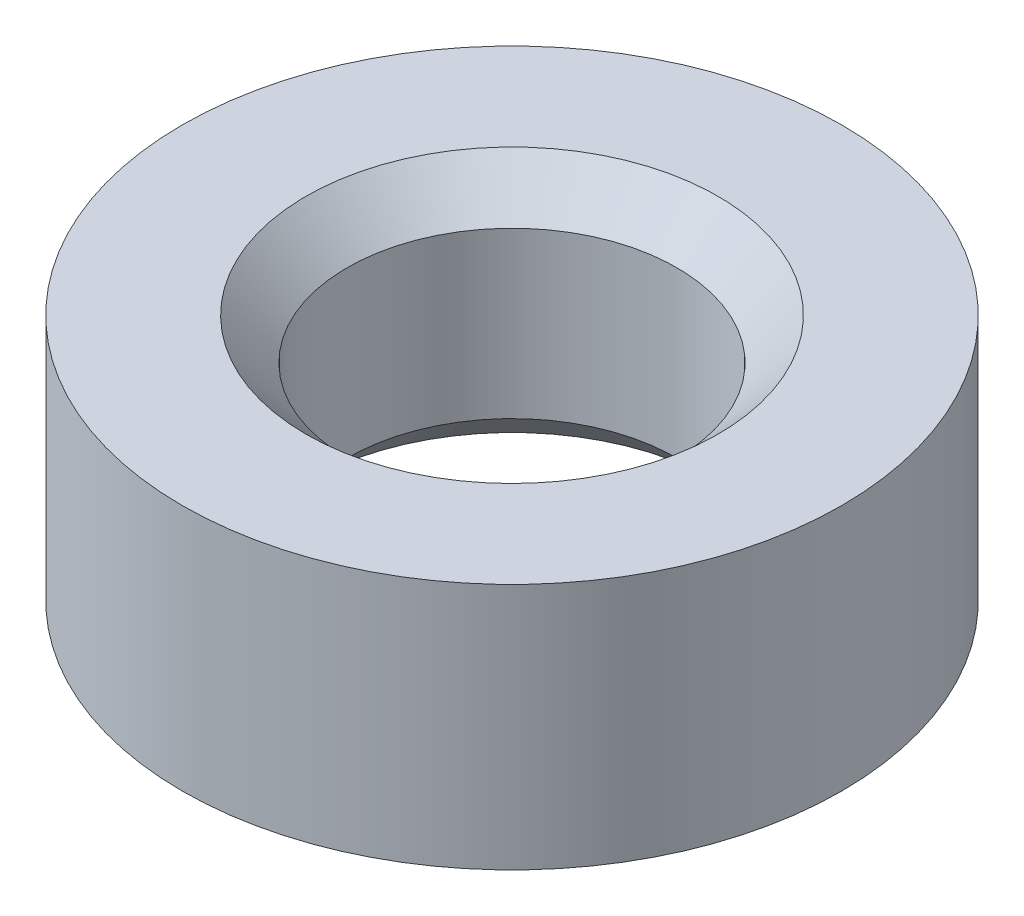
from build123d import *

# Parameters (mm, degrees)
SKETCH1_R           = 4
BOSS_EXTRUDE1_DEPTH = 3
SKETCH2_R           = 2
CUT_EXTRUDE1_DEPTH  = 7.403124237
CHAMFER2_SIZE       = 0.5


with BuildPart() as part:
    # Sketch1 → Boss-Extrude1 (new body)
    with BuildSketch(Plane(origin=(0, 0, 0), x_dir=(1, 0, 0), z_dir=(0, 1, 0))):
        with Locations(Location((0, 0, 0), (0, 0, 270))):
            Circle(SKETCH1_R)
    extrude(amount=BOSS_EXTRUDE1_DEPTH)

    # Sketch2 → Cut-Extrude1 (cut, through all)
    with BuildSketch(Plane(origin=(0, 3, 0), x_dir=(1, 0, 0), z_dir=(0, 1, 0))):
        with Locations(Location((0, 0, 0), (0, 0, 270))):
            Circle(SKETCH2_R)
    extrude(amount=-CUT_EXTRUDE1_DEPTH, mode=Mode.SUBTRACT)

    # Chamfer2
    chamfer2_edges = [part.edges().sort_by_distance(p)[0] for p in [
        (0, 0, -2),
        (0, 3, -2),
    ]]
    chamfer(chamfer2_edges, length=CHAMFER2_SIZE)


solid = part.part
